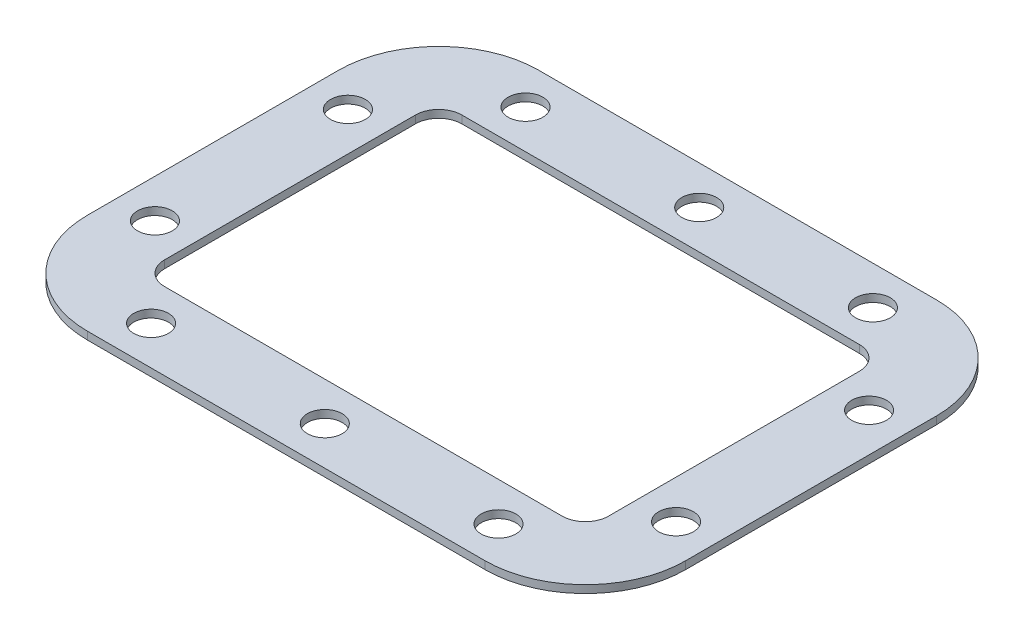
from build123d import *

# Parameters (mm, degrees)
EXTRUDE_1_DEPTH     = 2
SKETCH_4_R          = 4.5
CUT_EXTRUDE_1_DEPTH = 98.121058479


with BuildPart() as part:
    # Эскиз2 → Бобышка-Вытянуть1 (new body)
    with BuildSketch(Plane(origin=(0, 0, 0), x_dir=(1, 0, 0), z_dir=(0, 1, 0))):
        with BuildLine():
            Line((-51.5, -58.5), (51.5, -58.5))
            ThreePointArc((51.5, -58.5), (69.884776311, -50.884776311), (77.5, -32.5))
            Line((77.5, -32.5), (77.5, 32.5))
            ThreePointArc((77.5, 32.5), (69.884776311, 50.884776311), (51.5, 58.5))
            Line((51.5, 58.5), (-51.5, 58.5))
            ThreePointArc((-51.5, 58.5), (-69.884776311, 50.884776311), (-77.5, 32.5))
            Line((-77.5, 32.5), (-77.5, -32.5))
            ThreePointArc((-77.5, -32.5), (-69.884776311, -50.884776311), (-51.5, -58.5))
        make_face()
        with BuildLine():
            Line((-51.5, 38.5), (51.5, 38.5))
            ThreePointArc((51.5, 38.5), (55.742640687, 36.742640687), (57.5, 32.5))
            Line((57.5, 32.5), (57.5, -32.5))
            ThreePointArc((57.5, -32.5), (55.742640687, -36.742640687), (51.5, -38.5))
            Line((51.5, -38.5), (-51.5, -38.5))
            ThreePointArc((-51.5, -38.5), (-55.742640687, -36.742640687), (-57.5, -32.5))
            Line((-57.5, -32.5), (-57.5, 32.5))
            ThreePointArc((-57.5, 32.5), (-55.742640687, 36.742640687), (-51.5, 38.5))
        make_face(mode=Mode.SUBTRACT)
    extrude(amount=EXTRUDE_1_DEPTH)

    # Эскиз4 → Вырез-Вытянуть1 (cut, through all)
    with BuildSketch(Plane(origin=(0, 2, 0), x_dir=(1, 0, 0), z_dir=(0, 1, 0))):
        with Locations(Location((-45, -48.5, 0), (0, 0, 270))):
            Circle(SKETCH_4_R)
    cut_extrude_1 = extrude(amount=-CUT_EXTRUDE_1_DEPTH, mode=Mode.SUBTRACT)

    # Эскиз-Массив1: Вырез-Вытянуть1 at 9 more places
    with Locations((45, 0, 0), (90, 0, 0), (112.5, 0, -23.5), (112.5, 0, -73.5), (-22.5, 0, -23.5), (-22.5, 0, -73.5), (90, 0, -97), (45, 0, -97), (0, 0, -97)):
        add(cut_extrude_1, mode=Mode.SUBTRACT)


solid = part.part
